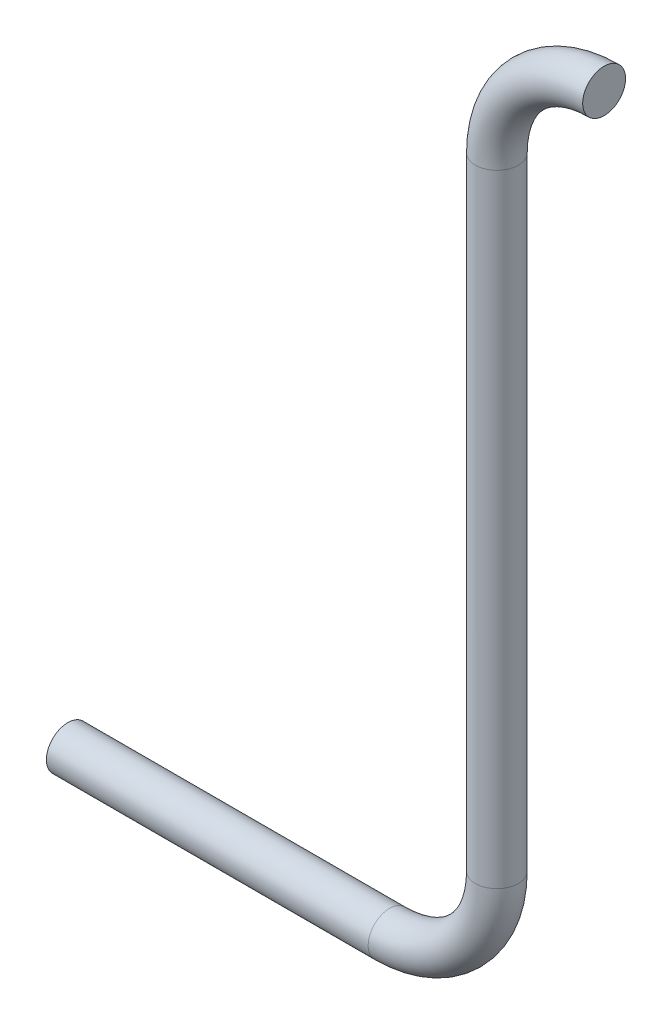
from build123d import *

# Parameters (mm, degrees)
SKETCH_2_R = 1


with BuildPart() as part:
    # По траектории1: sweep along a path in Эскиз1
    with BuildLine(Plane.XY) as sweep_1_path:
        Line((-25, -39), (-10, -39))
        ThreePointArc((-10, -39), (-6.464466094, -37.535533906), (-5, -34))
        Line((-5, -34), (-5, -5))
        ThreePointArc((-5, -5), (-3.535533906, -1.464466094), (0, 0))
    # Эскиз2 → По траектории1 (sweep)
    with BuildSketch(Plane(origin=(0, 0, 0), x_dir=(0, 0, -1), z_dir=(1, 0, 0))):
        Circle(SKETCH_2_R)
    sweep(path=sweep_1_path.line)


solid = part.part
